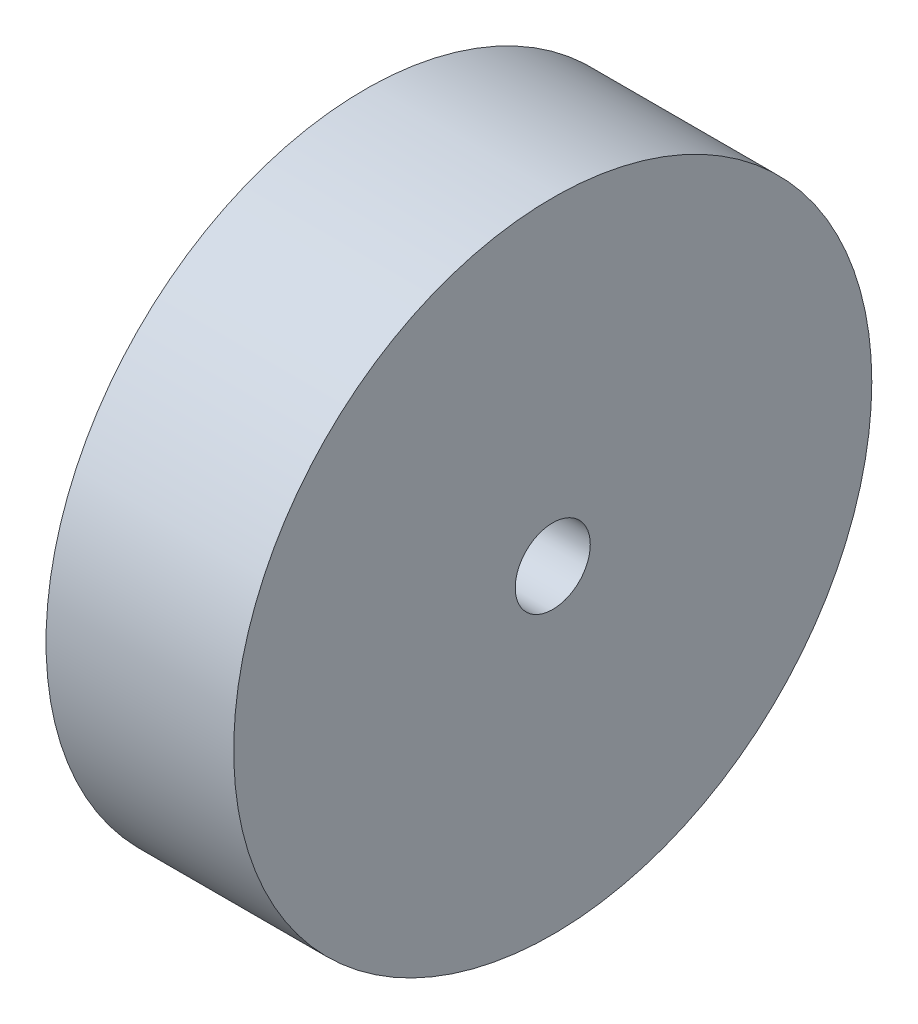
from build123d import *

# Parameters (mm, degrees)
BROCA_DE_ROSQUEAR_PARA_TARRAXA_DE_M2_2X0_REACH = 30.443
BROCA_DE_ROSQUEAR_PARA_TARRAXA_DE_M2_2_R       = 0.875


with BuildPart() as part:
    # Esboço3 → Revolução1 (revolve)
    with BuildSketch(Plane.XY, mode=Mode.PRIVATE) as revolu_o1_sk:
        Polygon((0, 17), (0, 2), (-9, 2), (-9, 5), (-3, 5), (-3, 13), (-10, 13), (-10, 17), align=None)
    revolve(revolu_o1_sk.sketch.rotate(Axis((0, 0, 0), (-1, 0, 0)), 90), axis=Axis((0, 0, 0), (-1, 0, 0)))

    # Broca de rosquear para tarraxa de M2 2 (on position points) → Broca de rosquear para tarraxa de M2.2x0.451 (cut, up to next)
    with BuildSketch(Plane(origin=(-6, 5, 0), x_dir=(0, 0, 1), z_dir=(0, 1, 0)), mode=Mode.PRIVATE) as broca_de_rosquear_para_tarraxa_de_m2_2x0_sk1:
        Circle(BROCA_DE_ROSQUEAR_PARA_TARRAXA_DE_M2_2_R)
    broca_de_rosquear_para_tarraxa_de_m2_2x0_tool1 = extrude(broca_de_rosquear_para_tarraxa_de_m2_2x0_sk1.sketch, amount=-BROCA_DE_ROSQUEAR_PARA_TARRAXA_DE_M2_2X0_REACH, mode=Mode.PRIVATE) & part.part
    add(broca_de_rosquear_para_tarraxa_de_m2_2x0_tool1.solids().sort_by_distance((-6, 5, 0))[0], mode=Mode.SUBTRACT)


solid = part.part
